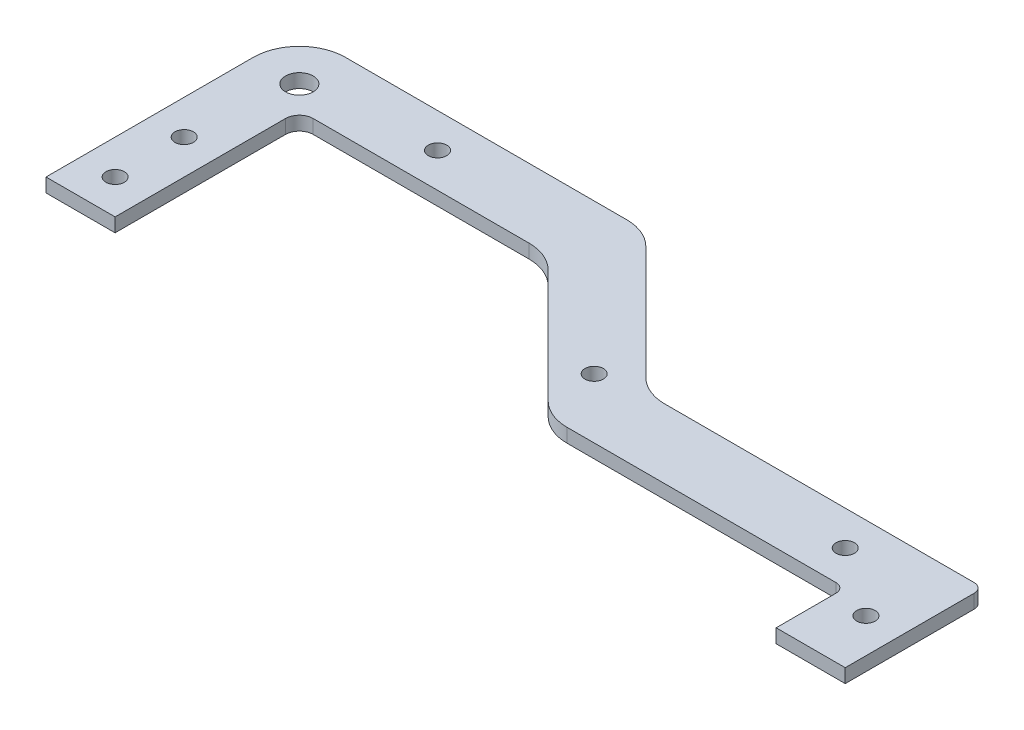
from build123d import *

# Parameters (mm, degrees)
EXTRUDE_1_DEPTH     = 3
SKETCH_2_R          = 2
SKETCH_2_R_2        = 3
CUT_EXTRUDE_1_DEPTH = 10
FILLET_1_R          = 10
FILLET_2_R          = 2
FILLET_3_R          = 3


with BuildPart() as part:
    # 草图1 → 凸台-拉伸1 (new body)
    with BuildSketch(Plane(origin=(0, 0, 0), x_dir=(1, 0, 0), z_dir=(0, 1, 0))):
        with BuildLine():
            Line((-55, 0), (-40, 0))
            Line((-40, 0), (-40, 30))
            Line((-40, 30), (-113.286796564, 30))
            Line((-113.286796564, 30), (-143.786796564, 60.5))
            Line((-143.786796564, 60.5), (-209, 60.5))
            ThreePointArc((-209, 60.5), (-216.071067812, 57.571067812), (-219, 50.5))
            Line((-219, 50.5), (-219, 5.5))
            Line((-219, 5.5), (-204, 5.5))
            Line((-204, 5.5), (-204, 45.5))
            Line((-204, 45.5), (-150, 45.5))
            Line((-150, 45.5), (-119.5, 15))
            Line((-119.5, 15), (-55, 15))
            Line((-55, 15), (-55, 0))
        make_face()
    extrude(amount=EXTRUDE_1_DEPTH)

    # 草图2 → 切除-拉伸1 (cut)
    with BuildSketch(Plane(origin=(0, 3, 0), x_dir=(1, 0, 0), z_dir=(0, 1, 0))):
        with Locations(Location((-47.5, 12, 0), (0, 0, 270))):
            Circle(SKETCH_2_R)
        with Locations(Location((-211.5, 13, 0), (0, 0, 270))):
            Circle(SKETCH_2_R)
        with Locations(Location((-211.5, 28, 0), (0, 0, 270))):
            Circle(SKETCH_2_R)
        with Locations(Location((-209, 50.5, 0), (0, 0, 270))):
            Circle(SKETCH_2_R_2)
        with Locations(Location((-181.5, 53, 0), (0, 0, 270))):
            Circle(SKETCH_2_R)
        with Locations(Location((-122.5, 28, 0), (0, 0, 270))):
            Circle(SKETCH_2_R)
        with Locations(Location((-62.5, 22.5, 0), (0, 0, 270))):
            Circle(SKETCH_2_R)
    extrude(amount=-CUT_EXTRUDE_1_DEPTH, mode=Mode.SUBTRACT)

    # 圆角1
    fillet_1_edges = [part.edges().sort_by_distance(p)[0] for p in [
        (-119.5, 1.5, -15),
        (-150, 1.5, -45.5),
        (-143.786796564, 1.5, -60.5),
        (-113.286796564, 1.5, -30),
    ]]
    fillet(fillet_1_edges, radius=FILLET_1_R)

    # 圆角2
    fillet_2_edges = [part.edges().sort_by_distance(p)[0] for p in [
        (-40, 1.5, -30),
        (-55, 1.5, -15),
    ]]
    fillet(fillet_2_edges, radius=FILLET_2_R)

    # 圆角3
    fillet_3_edges = [part.edges().sort_by_distance(p)[0] for p in [
        (-204, 1.5, -45.5),
    ]]
    fillet(fillet_3_edges, radius=FILLET_3_R)


solid = part.part
